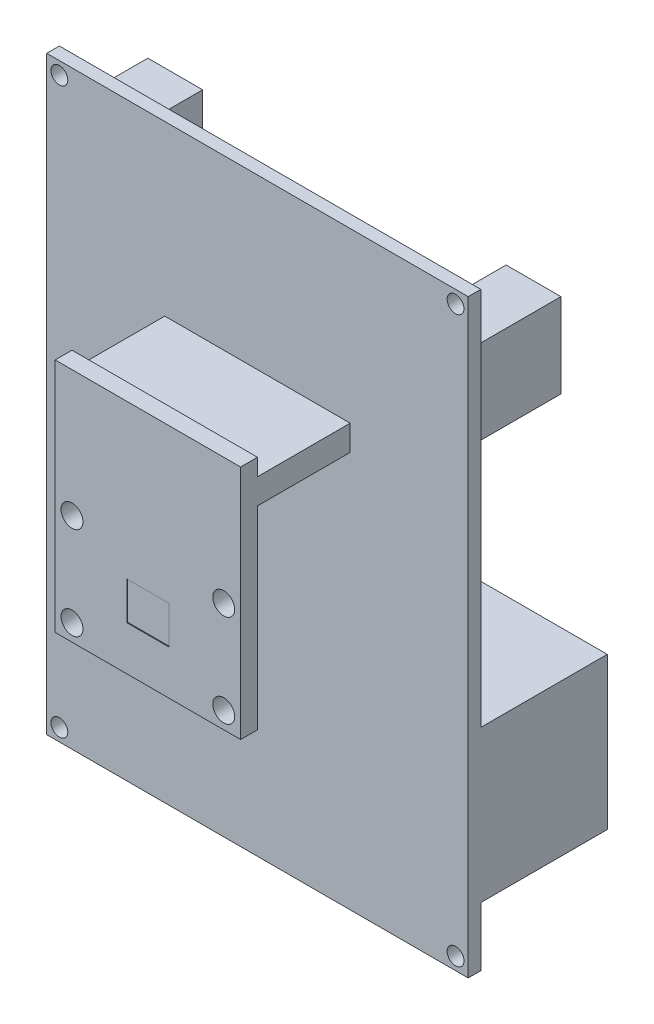
from build123d import *

# Parameters (mm, degrees)
SKETCH_1_W          = 50
SKETCH_1_H          = 70
EXTRUDE_1_DEPTH     = 1.5
SKETCH_2_R          = 1
CUT_EXTRUDE_1_DEPTH = 1.5
SKETCH_3_W          = 50
SKETCH_3_H          = 18
EXTRUDE_2_DEPTH     = 15
EXTRUDE_3_DEPTH     = 15
SKETCH_5_W          = 7
SKETCH_5_H          = 10
EXTRUDE_4_DEPTH     = 10
EXTRUDE_5_DEPTH     = 13
SKETCH_7_W          = 22
SKETCH_7_H          = 11
CUT_EXTRUDE_2_DEPTH = 23
CUT_EXTRUDE_3_DEPTH = 2
SKETCH_9_W          = 10
SKETCH_9_H          = 10
CUT_EXTRUDE_4_DEPTH = 0.5
SKETCH_10_W         = 10
SKETCH_10_H         = 10
CUT_EXTRUDE_5_DEPTH = 0.5
CUT_EXTRUDE_6_REACH = 54.156
SKETCH_11_R         = 1.3
SKETCH_12_W         = 5
SKETCH_12_H         = 4.5
CUT_EXTRUDE_8_DEPTH = 0.1


with BuildPart() as part:
    # 草图1 → 凸台-拉伸1 (new body)
    with BuildSketch(Plane.XY):
        Rectangle(SKETCH_1_W, SKETCH_1_H)
    extrude(amount=-EXTRUDE_1_DEPTH)

    # 草图2 → 切除-拉伸1 (cut)
    with BuildSketch(Plane.XY):
        with Locations((-23.5, 33.5)):
            Circle(SKETCH_2_R)
        with Locations(Location((23.5, 33.5, 0), (0, 0, 180))):
            Circle(SKETCH_2_R)
        with Locations((23.5, -33.5)):
            Circle(SKETCH_2_R)
        with Locations(Location((-23.5, -33.5, 0), (0, 0, 180))):
            Circle(SKETCH_2_R)
    extrude(amount=-CUT_EXTRUDE_1_DEPTH, mode=Mode.SUBTRACT)

    # 草图3 → 凸台-拉伸2 (add)
    with BuildSketch(Plane(origin=(0, 0, -1.5), x_dir=(-1, 0, 0), z_dir=(0, 0, -1))):
        with Locations((0, -19)):
            Rectangle(SKETCH_3_W, SKETCH_3_H)
    extrude(amount=EXTRUDE_2_DEPTH)

    # 草图4 → 凸台-拉伸3 (add)
    with BuildSketch(Plane(origin=(0, 0, -1.5), x_dir=(-1, 0, 0), z_dir=(0, 0, -1))):
        Polygon((-8, -2), (0, -2), (8, -2), (8, 12), (-8, 12), align=None)
    extrude(amount=EXTRUDE_3_DEPTH)

    # 草图5 → 凸台-拉伸4 (add)
    with BuildSketch(Plane(origin=(0, 0, -1.5), x_dir=(-1, 0, 0), z_dir=(0, 0, -1))):
        with Locations((-21.5, 24)):
            Rectangle(SKETCH_5_W, SKETCH_5_H)
        with Locations((21.5, 24)):
            Rectangle(SKETCH_5_W, SKETCH_5_H)
    extrude(amount=EXTRUDE_4_DEPTH)

    # 草图6 → 凸台-拉伸5 (add)
    with BuildSketch(Plane.XY):
        Polygon((0, 17), (11, 17), (11, -11), (-11, -11), (-11, 17), align=None)
    extrude(amount=EXTRUDE_5_DEPTH)

    # 草图7 → 切除-拉伸2 (cut)
    with BuildSketch(Plane(origin=(0, -11, 0), x_dir=(-1, 0, 0), z_dir=(0, -1, 0))):
        with Locations((0, -5.5)):
            Rectangle(SKETCH_7_W, SKETCH_7_H)
    extrude(amount=-CUT_EXTRUDE_2_DEPTH, mode=Mode.SUBTRACT)

    # 草图8 → 切除-拉伸3 (cut)
    with BuildSketch(Plane(origin=(0, 17, 0), x_dir=(1, 0, 0), z_dir=(0, 1, 0))):
        Polygon((0, 0), (11, 0), (11, -11), (-11, -11), (-11, 0), align=None)
    extrude(amount=-CUT_EXTRUDE_3_DEPTH, mode=Mode.SUBTRACT)

    # 草图9 → 切除-拉伸4 (cut)
    with BuildSketch(Plane.ZY.offset(25)):
        with Locations((-6.5, 24)):
            Rectangle(SKETCH_9_W, SKETCH_9_H)
    extrude(amount=-CUT_EXTRUDE_4_DEPTH, mode=Mode.SUBTRACT)

    # 草图10 → 切除-拉伸5 (cut)
    with BuildSketch(Plane(origin=(25, 0, 0), x_dir=(0, 0, -1), z_dir=(1, 0, 0))):
        with Locations((6.5, 24)):
            Rectangle(SKETCH_10_W, SKETCH_10_H)
    extrude(amount=-CUT_EXTRUDE_5_DEPTH, mode=Mode.SUBTRACT)

    # 草图11 → 切除-拉伸6 (cut, up to next)
    with BuildSketch(Plane.XY.offset(13), mode=Mode.PRIVATE) as cut_extrude_6_sk1:
        with Locations((-9, 2)):
            Circle(SKETCH_11_R)
    cut_extrude_6_tool1 = extrude(cut_extrude_6_sk1.sketch, amount=-CUT_EXTRUDE_6_REACH, mode=Mode.PRIVATE) & part.part
    # 草图11 → 切除-拉伸6 (cut, up to next)
    with BuildSketch(Plane.XY.offset(13), mode=Mode.PRIVATE) as cut_extrude_6_sk2:
        with Locations((-9, -9)):
            Circle(SKETCH_11_R)
    cut_extrude_6_tool2 = extrude(cut_extrude_6_sk2.sketch, amount=-CUT_EXTRUDE_6_REACH, mode=Mode.PRIVATE) & part.part
    # 草图11 → 切除-拉伸6 (cut, up to next)
    with BuildSketch(Plane.XY.offset(13), mode=Mode.PRIVATE) as cut_extrude_6_sk3:
        with Locations((9, 2)):
            Circle(SKETCH_11_R)
    cut_extrude_6_tool3 = extrude(cut_extrude_6_sk3.sketch, amount=-CUT_EXTRUDE_6_REACH, mode=Mode.PRIVATE) & part.part
    # 草图11 → 切除-拉伸6 (cut, up to next)
    with BuildSketch(Plane.XY.offset(13), mode=Mode.PRIVATE) as cut_extrude_6_sk4:
        with Locations((9, -9)):
            Circle(SKETCH_11_R)
    cut_extrude_6_tool4 = extrude(cut_extrude_6_sk4.sketch, amount=-CUT_EXTRUDE_6_REACH, mode=Mode.PRIVATE) & part.part
    add(cut_extrude_6_tool1.solids().sort_by_distance((-9, 2, 13))[0], mode=Mode.SUBTRACT)
    add(cut_extrude_6_tool2.solids().sort_by_distance((-9, -9, 13))[0], mode=Mode.SUBTRACT)
    add(cut_extrude_6_tool3.solids().sort_by_distance((9, 2, 13))[0], mode=Mode.SUBTRACT)
    add(cut_extrude_6_tool4.solids().sort_by_distance((9, -9, 13))[0], mode=Mode.SUBTRACT)

    # 草图12 → 切除-拉伸8 (cut)
    with BuildSketch(Plane.XY.offset(13)):
        with Locations((0, -3.5)):
            Rectangle(SKETCH_12_W, SKETCH_12_H)
    extrude(amount=-CUT_EXTRUDE_8_DEPTH, mode=Mode.SUBTRACT)


solid = part.part
